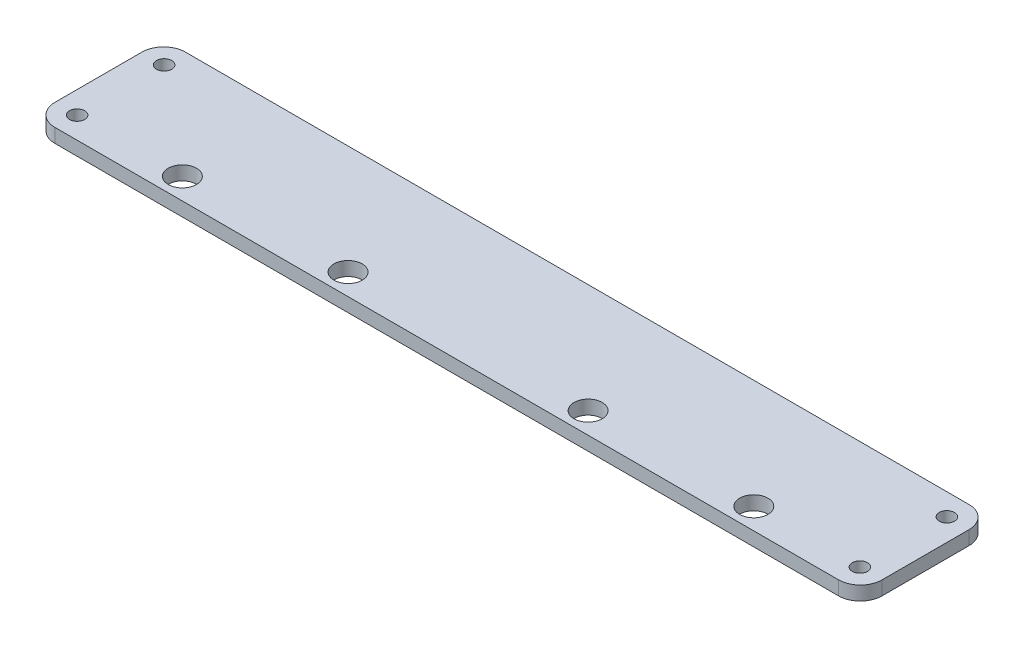
from build123d import *

# Parameters (mm, degrees)
SKETCH1_W           = 190.2
SKETCH1_H           = 30
BOSS_EXTRUDE1_DEPTH = 3.2
SKETCH2_R           = 1.75
CUT_EXTRUDE1_DEPTH  = 97.328863795
SKETCH3_R           = 3.25
CUT_EXTRUDE2_DEPTH  = 97.328863795
FILLET1_R           = 5


with BuildPart() as part:
    # Sketch1 → Boss-Extrude1 (new body)
    with BuildSketch(Plane(origin=(0, 0, 0), x_dir=(1, 0, 0), z_dir=(0, 1, 0))):
        Rectangle(SKETCH1_W, SKETCH1_H)
    extrude(amount=BOSS_EXTRUDE1_DEPTH)

    # Sketch2 → Cut-Extrude1 (cut, through all)
    with BuildSketch(Plane(origin=(0, 3.2, 0), x_dir=(1, 0, 0), z_dir=(0, 1, 0))):
        with Locations(Location((-90, 10, 0), (0, 0, 270))):
            Circle(SKETCH2_R)
        with Locations(Location((-90, -10, 0), (0, 0, 270))):
            Circle(SKETCH2_R)
        with Locations(Location((90, 10, 0), (0, 0, 270))):
            Circle(SKETCH2_R)
        with Locations(Location((90, -10, 0), (0, 0, 270))):
            Circle(SKETCH2_R)
    extrude(amount=-CUT_EXTRUDE1_DEPTH, mode=Mode.SUBTRACT)

    # Sketch3 → Cut-Extrude2 (cut, through all)
    with BuildSketch(Plane(origin=(0, 3.2, 0), x_dir=(1, 0, 0), z_dir=(0, 1, 0))):
        with Locations(Location((65.7, -10.1, 0), (0, 0, 270))):
            Circle(SKETCH3_R)
        with Locations(Location((27.6, -10.1, 0), (0, 0, 270))):
            Circle(SKETCH3_R)
        with Locations(Location((-27.6, -10.1, 0), (0, 0, 270))):
            Circle(SKETCH3_R)
        with Locations(Location((-65.7, -10.1, 0), (0, 0, 270))):
            Circle(SKETCH3_R)
    extrude(amount=-CUT_EXTRUDE2_DEPTH, mode=Mode.SUBTRACT)

    # Fillet1
    fillet1_edges = [part.edges().sort_by_distance(p)[0] for p in [
        (95.1, 1.6, 15),
        (-95.1, 1.6, 15),
        (-95.1, 1.6, -15),
        (95.1, 1.6, -15),
    ]]
    fillet(fillet1_edges, radius=FILLET1_R)


solid = part.part
